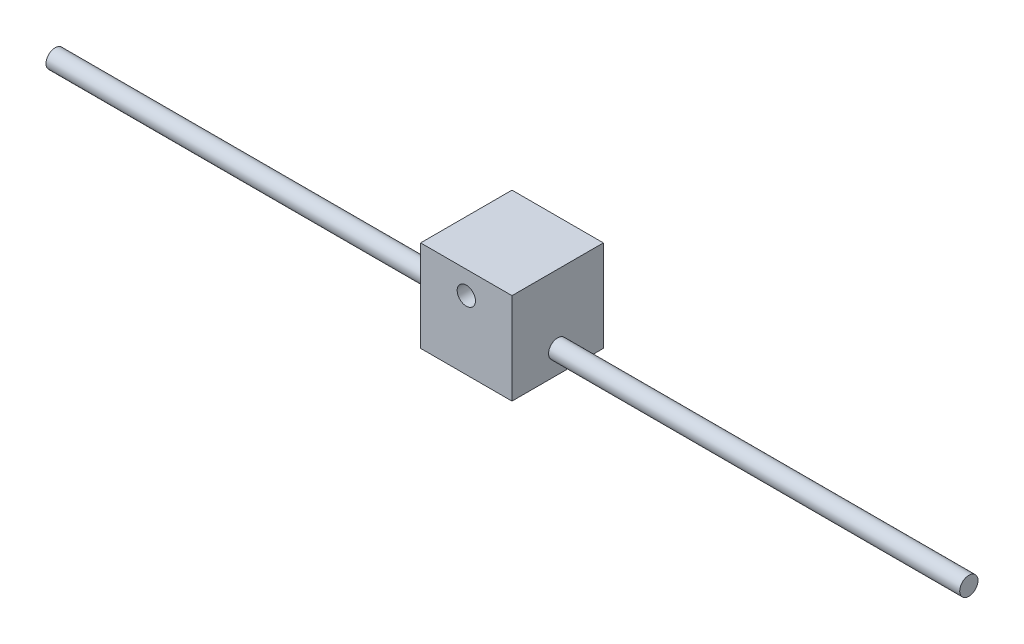
from build123d import *

# Parameters (mm, degrees)
ESQUISSE1_W             = 40
ESQUISSE1_H             = 40
ESQUISSE1_R             = 4
BOSS_EXTRU_1_DEPTH      = 20
ESQUISSE2_R             = 4
ENL_V_MAT_EXTRU_1_DEPTH = 49.989794856
ESQUISSE3_R             = 4
BOSS_EXTRU_2_DEPTH      = 200


with BuildPart() as part:
    # Esquisse1 → Boss.-Extru.1 (new, symmetric)
    with BuildSketch(Plane.XY):
        Rectangle(ESQUISSE1_W, ESQUISSE1_H)
        with Locations((0, 10)):
            Circle(ESQUISSE1_R, mode=Mode.SUBTRACT)
    extrude(amount=BOSS_EXTRU_1_DEPTH, both=True)

    # Esquisse2 → Enlèv. mat.-Extru.1 (cut, through all)
    with BuildSketch(Plane(origin=(20, 0, 0), x_dir=(0, 0, -1), z_dir=(1, 0, 0))):
        with Locations((0, -10)):
            Circle(ESQUISSE2_R)
    extrude(amount=-ENL_V_MAT_EXTRU_1_DEPTH, mode=Mode.SUBTRACT)


with BuildPart() as body_2:
    # Esquisse3 → Boss.-Extru.2 (new, symmetric)
    with BuildSketch(Plane(origin=(0, 0, 0), x_dir=(0, 0, -1), z_dir=(1, 0, 0))):
        with Locations((0, -10)):
            Circle(ESQUISSE3_R)
    extrude(amount=BOSS_EXTRU_2_DEPTH, both=True)


solid = Compound([part.part, body_2.part])
